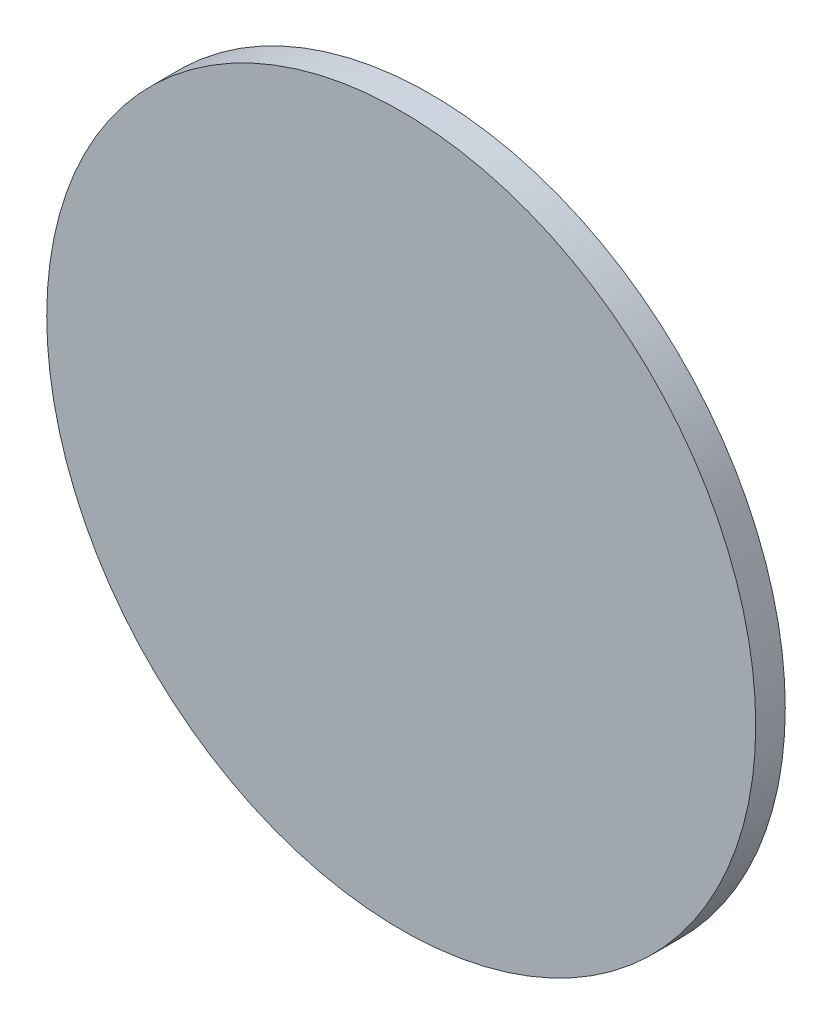
from build123d import *

# Parameters (mm, degrees)
SKETCH1_R           = 38.1
BOSS_EXTRUDE1_DEPTH = 1.5875


with BuildPart() as part:
    # Sketch1 → Boss-Extrude1 (new, symmetric)
    with BuildSketch(Plane.XY):
        Circle(SKETCH1_R)
    extrude(amount=BOSS_EXTRUDE1_DEPTH, both=True)


solid = part.part
